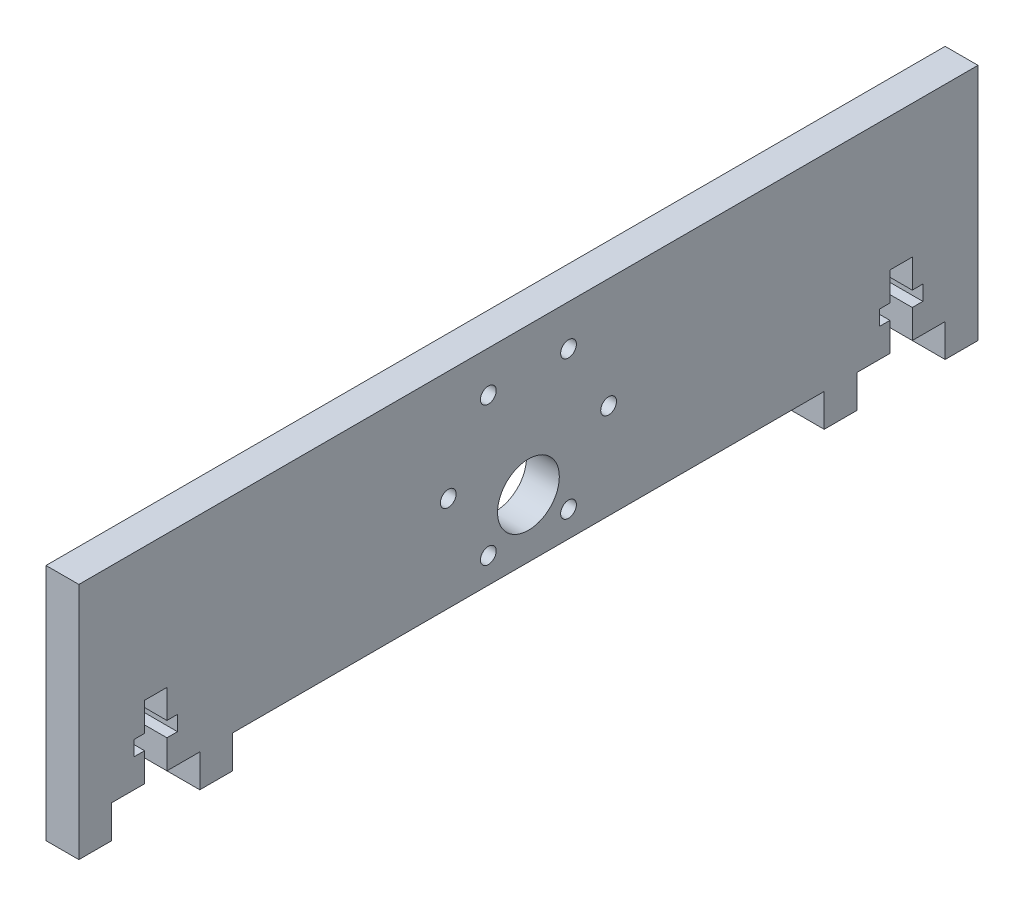
from build123d import *

# Parameters (mm, degrees)
MOTOR_PLATE_R       = 1.524
MOTOR_PLATE_R_2     = 5.969
BOSS_EXTRUDE1_DEPTH = 6.35


with BuildPart() as part:
    # Motor plate → Boss-Extrude1 (new body)
    with BuildSketch(Plane(origin=(0, 0, 0), x_dir=(0, 0, -1), z_dir=(1, 0, 0))):
        Polygon((-57.15, -19.853598803), (57.15, -19.853598803), (57.15, -26.203598803), (63.5, -26.203598803), (63.5, -19.853598803), (69.85, -19.853598803), (69.85, -14.318598824), (67.809000018, -14.318598824), (67.809000018, -11.418598782), (69.85, -11.418598782), (69.85, -5.883598803), (74.168, -5.883598803), (74.168, -11.418598782), (76.208999982, -11.418598782), (76.208999982, -14.318598824), (74.168, -14.318598824), (74.168, -19.853598803), (80.518, -19.853598803), (80.518, -26.203598803), (86.868, -26.203598803), (86.868, -19.853598803), (86.868, 19.853598803), (57.15, 19.853598803), (-57.15, 19.853598803), (-86.868, 19.853598803), (-86.868, -19.853598803), (-86.868, -26.203598803), (-80.518, -26.203598803), (-80.518, -19.853598803), (-74.168, -19.853598803), (-74.168, -14.318598824), (-76.208999982, -14.318598824), (-76.208999982, -11.418598782), (-74.168, -11.418598782), (-74.168, -5.883598803), (-69.85, -5.883598803), (-69.85, -11.418598782), (-67.809000018, -11.418598782), (-67.809000018, -14.318598824), (-69.85, -14.318598824), (-69.85, -19.853598803), (-63.5, -19.853598803), (-63.5, -26.203598803), (-57.15, -26.203598803), align=None)
        with Locations((-7.747, -14.856796409)):
            Circle(MOTOR_PLATE_R, mode=Mode.SUBTRACT)
        with Locations((0, -8.550598803)):
            Circle(MOTOR_PLATE_R_2, mode=Mode.SUBTRACT)
        with Locations((7.747, -14.856796409)):
            Circle(MOTOR_PLATE_R, mode=Mode.SUBTRACT)
        with Locations((-15.494, -1.438598803)):
            Circle(MOTOR_PLATE_R, mode=Mode.SUBTRACT)
        with Locations((-7.747, 11.979598803)):
            Circle(MOTOR_PLATE_R, mode=Mode.SUBTRACT)
        with Locations((15.494, -1.438598803)):
            Circle(MOTOR_PLATE_R, mode=Mode.SUBTRACT)
        with Locations((7.747, 11.979598803)):
            Circle(MOTOR_PLATE_R, mode=Mode.SUBTRACT)
    extrude(amount=BOSS_EXTRUDE1_DEPTH)


solid = part.part
